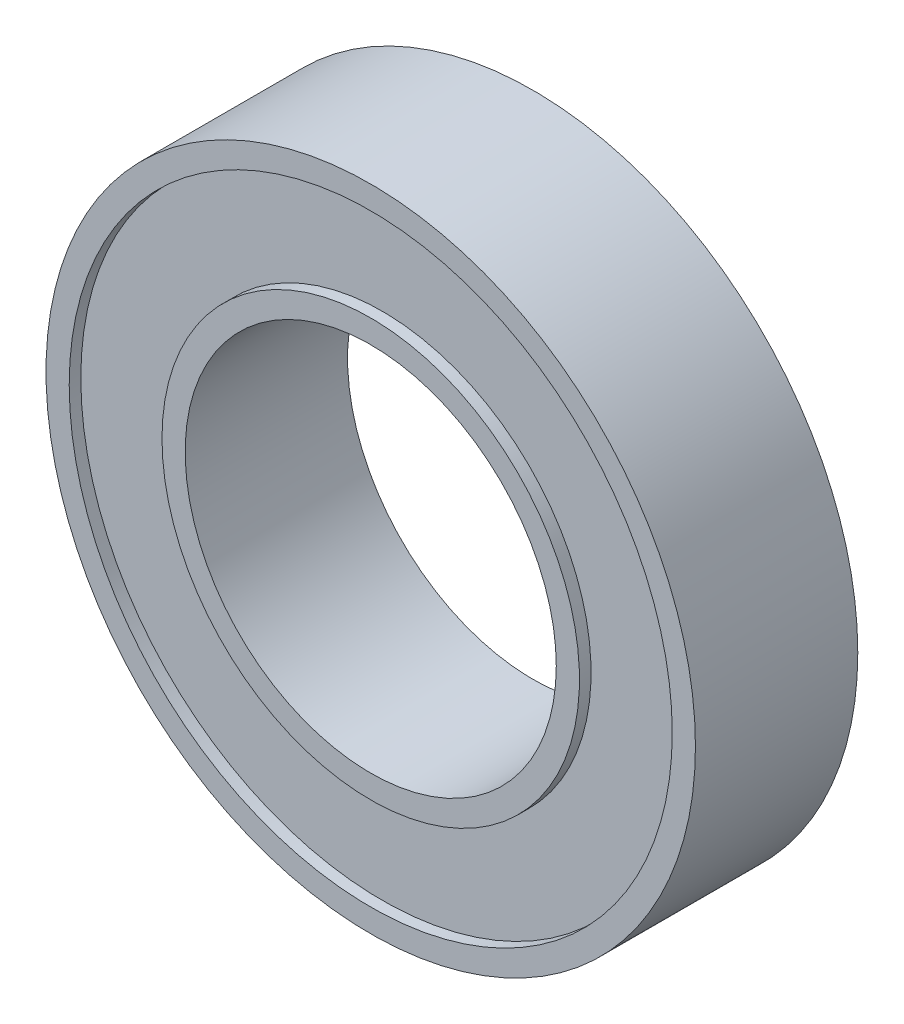
from build123d import *

# Parameters (mm, degrees)
SKETCH1_R           = 14
SKETCH1_R_2         = 8
BOSS_EXTRUDE1_DEPTH = 3.5
CUT_EXTRUDE1_START  = -0.5
SKETCH2_R           = 13
SKETCH2_R_2         = 9
CUT_EXTRUDE1_DEPTH  = 22.5


with BuildPart() as part:
    # Sketch1 → Boss-Extrude1 (new, symmetric)
    with BuildSketch(Plane.XY):
        Circle(SKETCH1_R)
        Circle(SKETCH1_R_2, mode=Mode.SUBTRACT)
    extrude(amount=BOSS_EXTRUDE1_DEPTH, both=True)

    # Sketch2 → Cut-Extrude1 (cut)
    with BuildSketch(Plane.XY.offset(3.5).offset(CUT_EXTRUDE1_START)):
        with Locations(Location((0, 0, 0), (0, 0, 180))):
            Circle(SKETCH2_R)
        with Locations(Location((0, 0, 0), (0, 0, 180))):
            Circle(SKETCH2_R_2, mode=Mode.SUBTRACT)
    cut_extrude1 = extrude(amount=CUT_EXTRUDE1_DEPTH, mode=Mode.SUBTRACT)

    # Mirror1: Cut-Extrude1 across plane
    add(cut_extrude1.mirror(Plane.XY), mode=Mode.SUBTRACT)

    # Mirror1 at the second plane: Cut-Extrude1 across plane
    add(cut_extrude1.mirror(Plane(origin=(0, 0, 0), x_dir=(0, 0, 1), z_dir=(1, 0, 0))), mode=Mode.SUBTRACT)


solid = part.part
